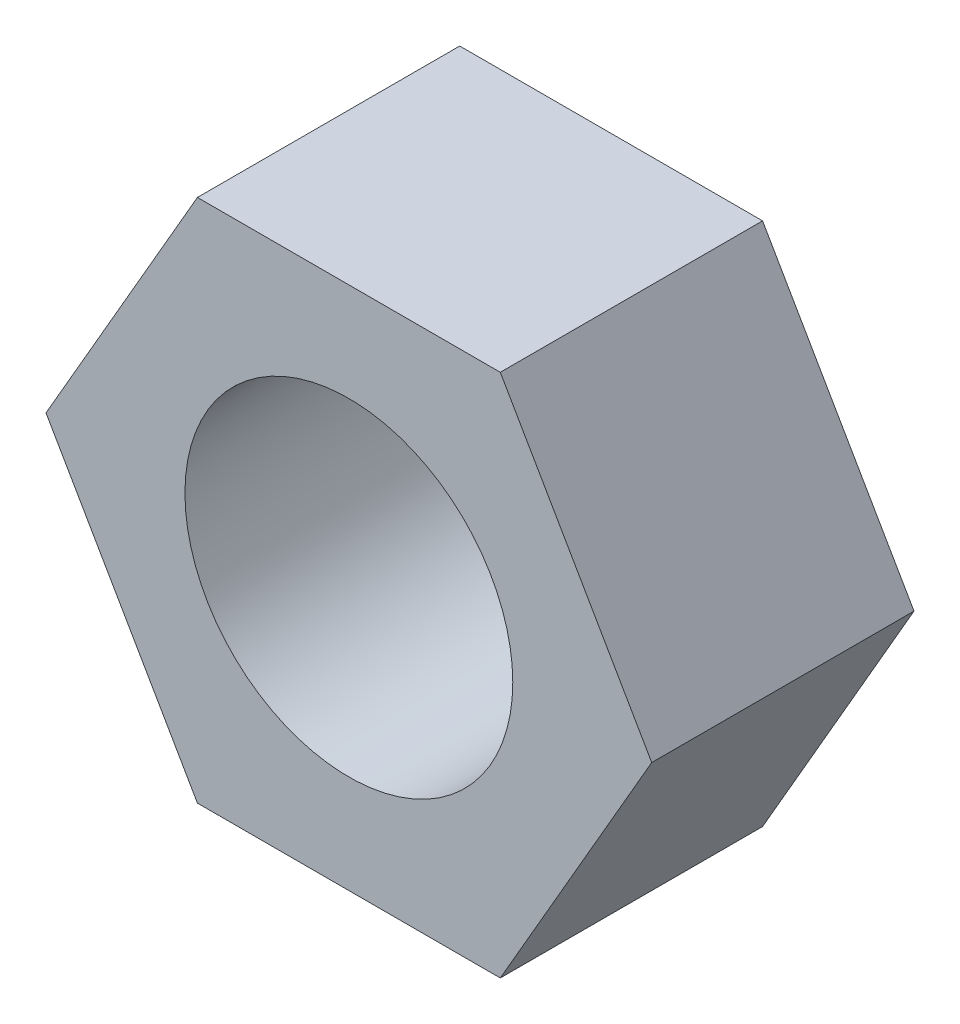
from build123d import *

# Parameters (mm, degrees)
ESQUISSE1_R        = 2.5
BOSS_EXTRU_1_DEPTH = 4


with BuildPart() as part:
    # Esquisse1 → Boss.-Extru.1 (new body)
    with BuildSketch(Plane.XY):
        Polygon((4.618802154, 0), (2.309401077, 4), (-2.309401077, 4), (-4.618802154, 0), (-2.309401077, -4), (2.309401077, -4), align=None)
        Circle(ESQUISSE1_R, mode=Mode.SUBTRACT)
    extrude(amount=BOSS_EXTRU_1_DEPTH)


solid = part.part
